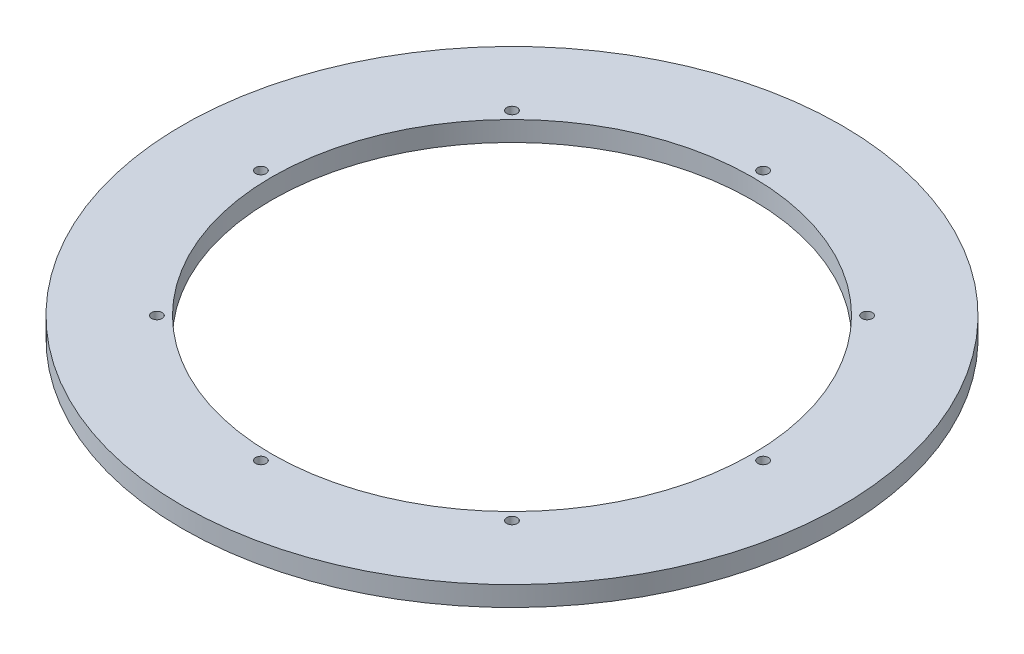
from build123d import *

# Parameters (mm, degrees)
SKETCH1_W          = 85.5
SKETCH1_H          = 19
SKETCH2_R          = 5
CUT_EXTRUDE1_DEPTH = 446.882271457


with BuildPart() as part:
    # Sketch1 → Revolve1 (revolve)
    with BuildSketch(Plane(origin=(0, 0, 0), x_dir=(0, 0, -1), z_dir=(1, 0, 0)), mode=Mode.PRIVATE) as revolve1_sk:
        with Locations((-272.25, -18.279378005)):
            Rectangle(SKETCH1_W, SKETCH1_H)
    revolve(revolve1_sk.sketch.rotate(Axis((0, -6970.88671751, 0), (0, 1, 0)), 180), axis=Axis((0, -6970.88671751, 0), (0, 1, 0)))

    # Sketch2 → Cut-Extrude1 (cut, through all)
    with BuildSketch(Plane(origin=(0, -8.779378005, 0), x_dir=(1, 0, 0), z_dir=(0, 1, 0))):
        with Locations(Location((0, 240, 0), (0, 0, 270))):
            Circle(SKETCH2_R)
        with Locations(Location((169.705627485, 169.705627485, 0), (0, 0, 270))):
            Circle(SKETCH2_R)
        with Locations(Location((240, 0, 0), (0, 0, 270))):
            Circle(SKETCH2_R)
        with Locations(Location((169.705627485, -169.705627485, 0), (0, 0, 270))):
            Circle(SKETCH2_R)
        with Locations(Location((0, -240, 0), (0, 0, 270))):
            Circle(SKETCH2_R)
        with Locations(Location((-169.705627485, -169.705627485, 0), (0, 0, 270))):
            Circle(SKETCH2_R)
        with Locations(Location((-240, 0, 0), (0, 0, 270))):
            Circle(SKETCH2_R)
        with Locations(Location((-169.705627485, 169.705627485, 0), (0, 0, 270))):
            Circle(SKETCH2_R)
    extrude(amount=-CUT_EXTRUDE1_DEPTH, mode=Mode.SUBTRACT)


solid = part.part
